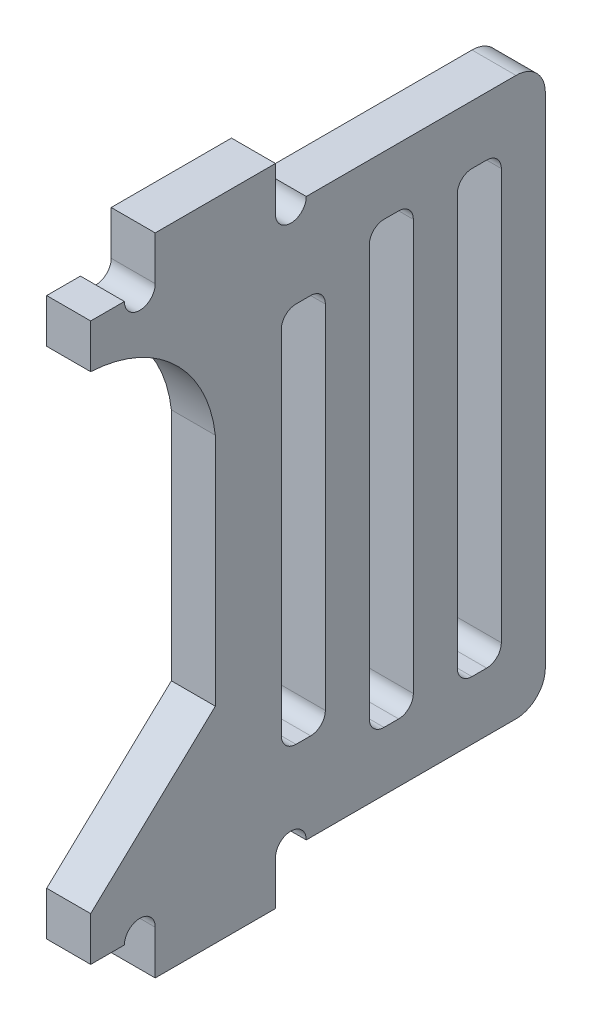
from build123d import *

# Parameters (mm, degrees)
EXTRUDE_1_DEPTH     = 3
SKETCH_4_W          = 14
SKETCH_4_H          = 38
SKETCH_4_W_2        = 3
SKETCH_4_H_2        = 30
EXTRUDE_2_DEPTH     = 3
FILLET_1_R          = 2
SKETCH_5_W          = 3
SKETCH_5_H          = 26
CUT_EXTRUDE_1_DEPTH = 10
FILLET_2_R          = 1


with BuildPart() as part:
    # 草图1 → 凸台-拉伸1 (new body)
    with BuildSketch(Plane(origin=(0, 0, 0), x_dir=(0, 0, -1), z_dir=(1, 0, 0))):
        with BuildLine():
            Line((-4.1, 22), (-4.1, 19))
            ThreePointArc((-4.1, 19), (-5.15, 17.95), (-6.2, 19))
            Line((-6.2, 19), (-8.5, 19))
            Line((-8.5, 19), (-8.5, -19))
            Line((-8.5, -19), (-6.2, -19))
            ThreePointArc((-6.2, -19), (-5.15, -17.95), (-4.1, -19))
            Line((-4.1, -19), (-4.1, -22))
            Line((-4.1, -22), (4.1, -22))
            Line((4.1, -22), (4.1, -19))
            ThreePointArc((4.1, -19), (5.15, -17.95), (6.2, -19))
            Line((6.2, -19), (8.5, -19))
            Line((8.5, -19), (8.5, 19))
            Line((8.5, 19), (6.2, 19))
            ThreePointArc((6.2, 19), (5.15, 17.95), (4.1, 19))
            Line((4.1, 19), (4.1, 22))
            Line((4.1, 22), (-4.1, 22))
        make_face()
    extrude(amount=EXTRUDE_1_DEPTH)

    # 草图4 → 凸台-拉伸2 (add)
    with BuildSketch(Plane(origin=(3, 0, 0), x_dir=(0, 0, -1), z_dir=(1, 0, 0))):
        with Locations((15.5, 0)):
            Rectangle(SKETCH_4_W, SKETCH_4_H)
        with Locations((12, 0)):
            Rectangle(SKETCH_4_W_2, SKETCH_4_H_2, mode=Mode.SUBTRACT)
        with Locations((18, 0)):
            Rectangle(SKETCH_4_W_2, SKETCH_4_H_2, mode=Mode.SUBTRACT)
    extrude(amount=-EXTRUDE_2_DEPTH)

    # 圆角1
    fillet_1_edges = [part.edges().sort_by_distance(p)[0] for p in [
        (1.5, -19, -22.5),
        (1.5, 19, -22.5),
    ]]
    fillet(fillet_1_edges, radius=FILLET_1_R)

    # 草图5 → 切除-拉伸1 (cut)
    with BuildSketch(Plane(origin=(3, 0, 0), x_dir=(0, 0, -1), z_dir=(1, 0, 0))):
        with BuildLine():
            Line((-8.5, -16), (0, -8))
            Line((0, -8), (0, 8))
            ThreePointArc((0, 8), (-2.777216236, 13.564832749), (-8.5, 16))
            Line((-8.5, 16), (-8.5, -16))
        make_face()
        with Locations((6, 0)):
            Rectangle(SKETCH_5_W, SKETCH_5_H)
    extrude(amount=-CUT_EXTRUDE_1_DEPTH, mode=Mode.SUBTRACT)

    # 圆角2
    fillet_2_edges = [part.edges().sort_by_distance(p)[0] for p in [
        (1.5, 13, -4.5),
        (1.5, 13, -7.5),
        (1.5, -13, -7.5),
        (1.5, -13, -4.5),
        (1.5, -15, -16.5),
        (1.5, -15, -19.5),
        (1.5, 15, -19.5),
        (1.5, 15, -16.5),
        (1.5, -15, -10.5),
        (1.5, -15, -13.5),
        (1.5, 15, -13.5),
        (1.5, 15, -10.5),
    ]]
    fillet(fillet_2_edges, radius=FILLET_2_R)


solid = part.part
